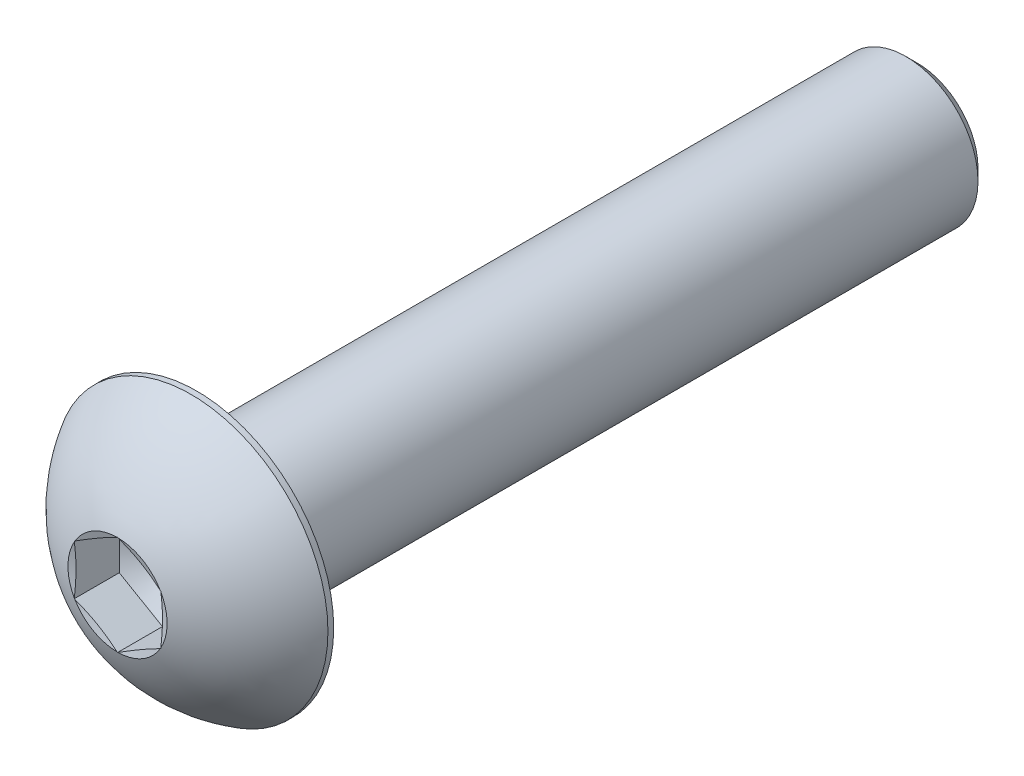
from build123d import *

# Parameters (mm, degrees)
CUT_EXTRUDE2_DEPTH = 1.56


with BuildPart() as part:
    # Sketch1 → Revolve1 (revolve)
    with BuildSketch(Plane(origin=(0, 0, 0), x_dir=(0, 0, -1), z_dir=(1, 0, 0)), mode=Mode.PRIVATE) as revolve1_sk:
        with BuildLine():
            Line((0, 0), (0, 1.72))
            ThreePointArc((0, 1.72), (1.005912159, 3.461460064), (2.55, 4.75))
            Line((2.55, 4.75), (2.75, 4.75))
            Line((2.75, 4.75), (2.75, 2.7))
            ThreePointArc((2.75, 2.7), (2.808578644, 2.558578644), (2.95, 2.5))
            Line((2.95, 2.5), (27.35, 2.5))
            Line((27.35, 2.5), (27.75, 2.1))
            Line((27.75, 2.1), (27.75, 0))
            Line((27.75, 0), (0, 0))
        make_face()
    revolve(revolve1_sk.sketch.rotate(Axis((0, 0, 0), (0, 0, -1)), 90), axis=Axis((0, 0, 0), (0, 0, -1)))

    # Sketch2 → Cut-Extrude2 (cut)
    with BuildSketch(Plane.XY):
        Polygon((0, -1.732050808), (1.5, -0.866025404), (1.5, 0.866025404), (0, 1.732050808), (-1.5, 0.866025404), (-1.5, -0.866025404), align=None)
    extrude(amount=-CUT_EXTRUDE2_DEPTH, mode=Mode.SUBTRACT)

    # Sketch5 → Cut-Revolve3 (revolve, cut)
    with BuildSketch(Plane(origin=(0, 0, 0), x_dir=(0, 0, -1), z_dir=(1, 0, 0)), mode=Mode.PRIVATE) as cut_revolve3_sk:
        Polygon((0.058948822, -1.5), (0, -1.72), (0, -1.5), align=None)
    revolve(cut_revolve3_sk.sketch.rotate(Axis((0, 0, 0), (0, 0, -1)), 119.297219146), axis=Axis((0, 0, 0), (0, 0, -1)), mode=Mode.SUBTRACT)

    # Sketch4 → Cut-Revolve2 (revolve, cut)
    with BuildSketch(Plane(origin=(0, 0, 0), x_dir=(0, 0, -1), z_dir=(1, 0, 0)), mode=Mode.PRIVATE) as cut_revolve2_sk:
        Polygon((1.56, 0), (1.56, -1.732050808), (2.56, 0), align=None)
    revolve(cut_revolve2_sk.sketch.rotate(Axis((0, 0, -1.56), (0, 0, -1)), 119.297219146), axis=Axis((0, 0, -1.56), (0, 0, -1)), mode=Mode.SUBTRACT)


solid = part.part
